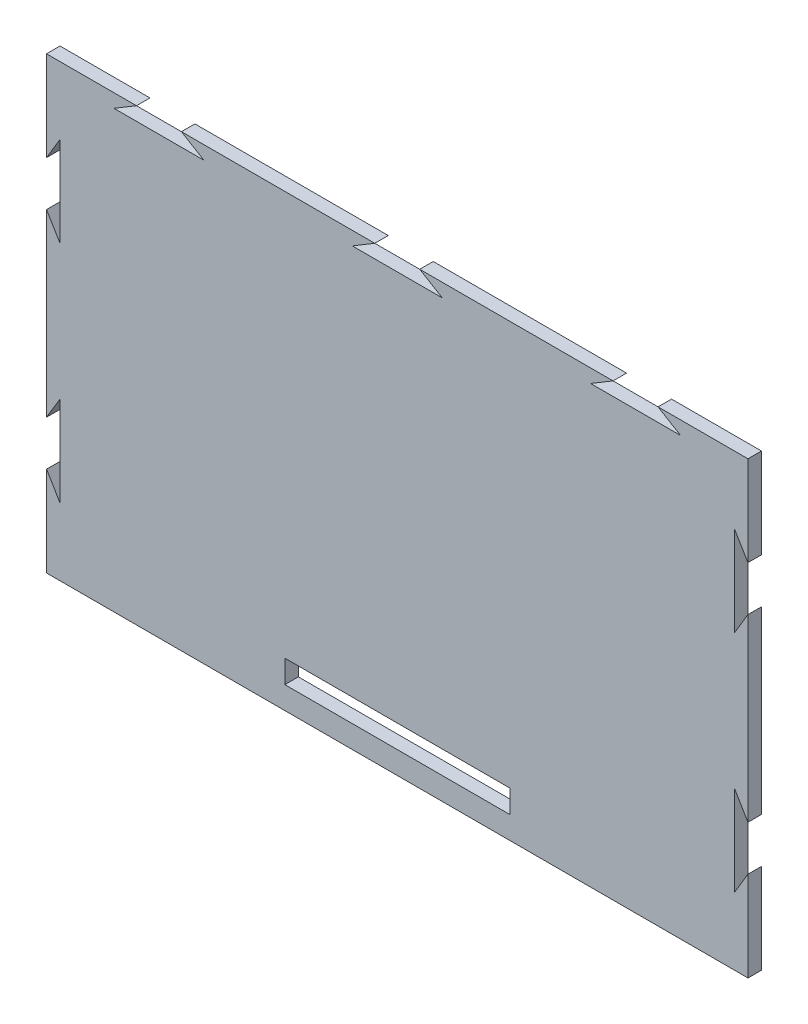
from build123d import *

# Parameters (mm, degrees)
ESQUISSE1_W             = 156
ESQUISSE1_H             = 100
BOSS_EXTRU_1_DEPTH      = 3
ENL_V_MAT_EXTRU_1_DEPTH = 3
ENL_V_MAT_EXTRU_3_DEPTH = 3
ENL_V_MAT_EXTRU_4_DEPTH = 3
ESQUISSE6_W             = 50.1
ESQUISSE6_H             = 5.1
ENL_V_MAT_EXTRU_5_DEPTH = 3


with BuildPart() as part:
    # Esquisse1 → Boss.-Extru.1 (new body)
    with BuildSketch(Plane.XY):
        Rectangle(ESQUISSE1_W, ESQUISSE1_H)
    extrude(amount=BOSS_EXTRU_1_DEPTH)

    # Esquisse2 → Enlèv. mat.-Extru.1 (cut)
    with BuildSketch(Plane(origin=(0, 0, 0), x_dir=(-1, 0, 0), z_dir=(0, 0, -1))):
        Polygon((-58, 50), (-63, 47), (-43, 47), (-48, 50), align=None)
        Polygon((-10, 47), (-5, 50), (5, 50), (10, 47), align=None)
        Polygon((48, 50), (43, 47), (63, 47), (58, 50), align=None)
    extrude(amount=-ENL_V_MAT_EXTRU_1_DEPTH, mode=Mode.SUBTRACT)

    # Esquisse4 → Enlèv. mat.-Extru.3 (cut)
    with BuildSketch(Plane(origin=(0, 0, 0), x_dir=(-1, 0, 0), z_dir=(0, 0, -1))):
        Polygon((-78, 30), (-75, 35), (-75, 15), (-78, 20), align=None)
        Polygon((-78, -20), (-75, -15), (-75, -35), (-78, -30), align=None)
    extrude(amount=-ENL_V_MAT_EXTRU_3_DEPTH, mode=Mode.SUBTRACT)

    # Esquisse5 → Enlèv. mat.-Extru.4 (cut)
    with BuildSketch(Plane(origin=(0, 0, 0), x_dir=(-1, 0, 0), z_dir=(0, 0, -1))):
        Polygon((78, 30), (75, 35), (75, 15), (78, 20), align=None)
        Polygon((78, -20), (75, -15), (75, -35), (78, -30), align=None)
    extrude(amount=-ENL_V_MAT_EXTRU_4_DEPTH, mode=Mode.SUBTRACT)

    # Esquisse6 → Enlèv. mat.-Extru.5 (cut)
    with BuildSketch(Plane(origin=(0, 0, 0), x_dir=(-1, 0, 0), z_dir=(0, 0, -1))):
        with Locations((-0.05, -42.45)):
            Rectangle(ESQUISSE6_W, ESQUISSE6_H)
    extrude(amount=-ENL_V_MAT_EXTRU_5_DEPTH, mode=Mode.SUBTRACT)


solid = part.part
